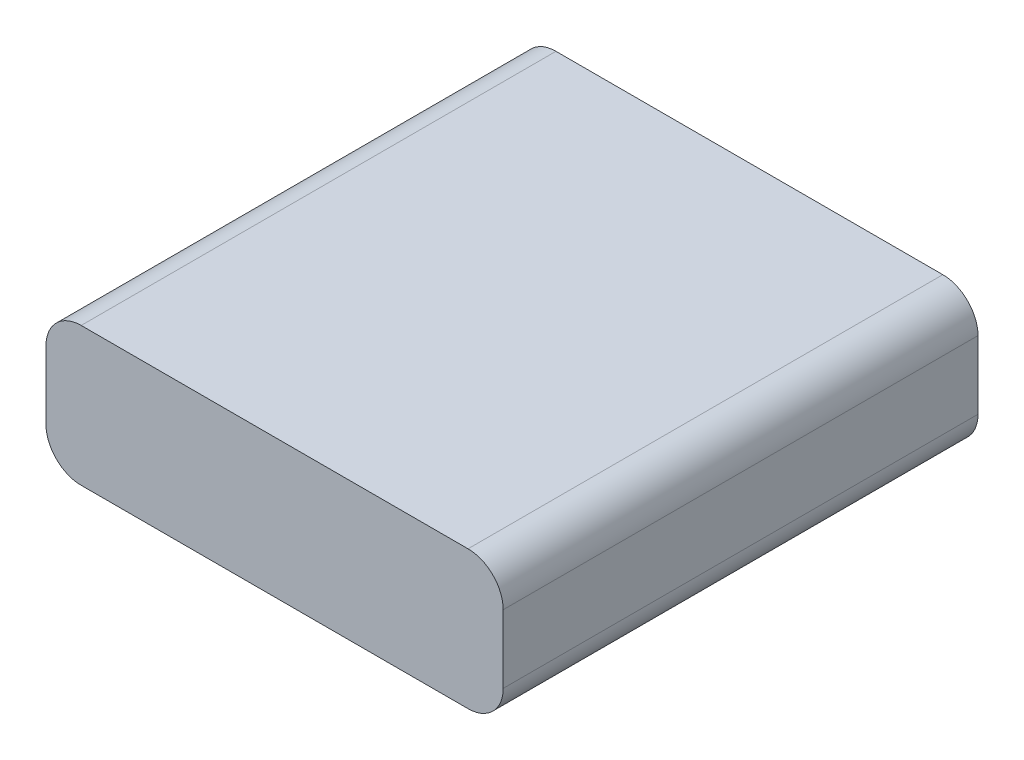
from build123d import *

# Parameters (mm, degrees)
SKETCH1_W      = 66.04
SKETCH1_H      = 68.58
EXTRUDE1_DEPTH = 20
FILLET1_R      = 5.08


with BuildPart() as part:
    # Sketch1 → Extrude1 (new body)
    with BuildSketch(Plane(origin=(0, 0, 0), x_dir=(1, 0, 0), z_dir=(0, 1, 0))):
        Rectangle(SKETCH1_W, SKETCH1_H)
    extrude(amount=EXTRUDE1_DEPTH)

    # Fillet1
    fillet1_edges = [part.edges().sort_by_distance(p)[0] for p in [
        (-33.02, 20, 0),
        (33.02, 20, 0),
        (-33.02, 0, 0),
        (33.02, 0, 0),
    ]]
    fillet(fillet1_edges, radius=FILLET1_R)


solid = part.part
